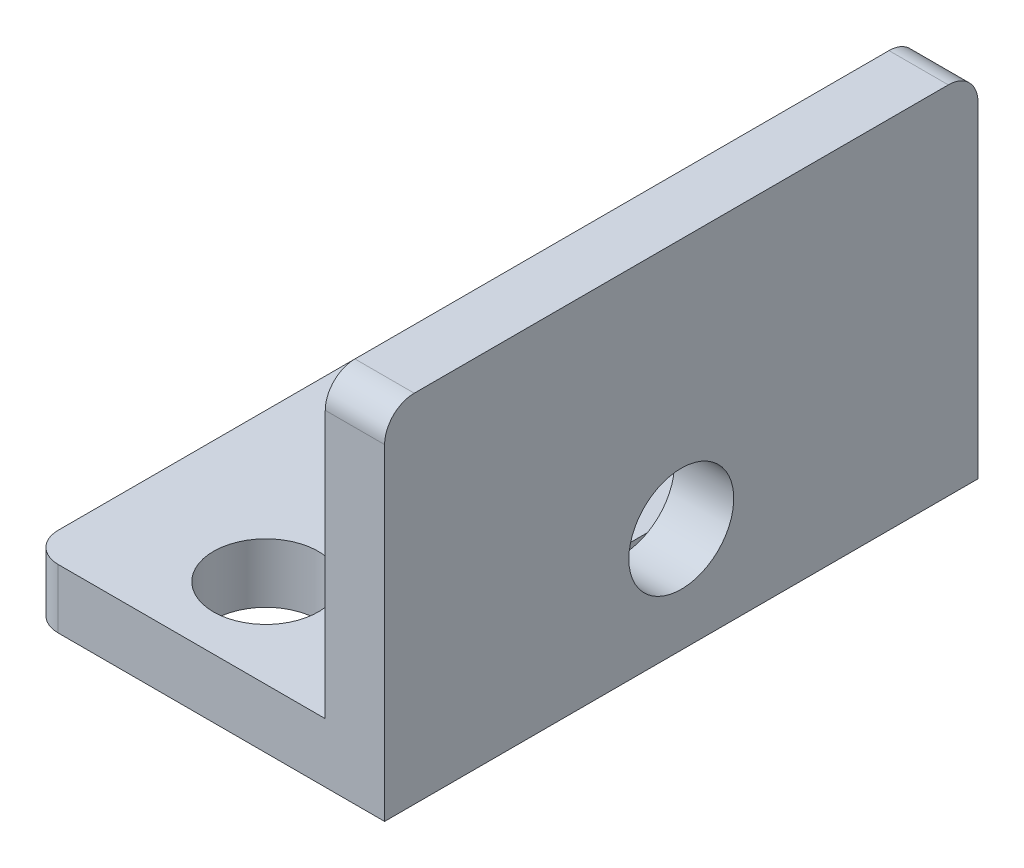
from build123d import *

# Parameters (mm, degrees)
BOSS_EXTRUDE1_DEPTH        = 31.75
F_10_CLEARANCE_HOLE1_D     = 5.6134
F_10_CLEARANCE_HOLE1_DEPTH = 25.4
F_10_CLEARANCE_HOLE1_TIP   = 1.686435499
FILLET1_R                  = 1.5875


with BuildPart() as part:
    # Sketch1 → Boss-Extrude1 (new body)
    with BuildSketch(Plane.XY):
        Polygon((0, 0), (0, 19.05), (-3.175, 19.05), (-3.175, 3.175), (-19.05, 3.175), (-19.05, 0), align=None)
    extrude(amount=BOSS_EXTRUDE1_DEPTH)

    # #10 Clearance Hole1
    with Locations(Plane(origin=(0, 3.175, 0), x_dir=(1, 0, 0), z_dir=(0, 1, 0))):
        with Locations((-11.1125, -26.9875), (-11.1125, -4.7625)):
            Hole(F_10_CLEARANCE_HOLE1_D / 2, depth=F_10_CLEARANCE_HOLE1_DEPTH)
            with Locations((0, 0, -(F_10_CLEARANCE_HOLE1_DEPTH + F_10_CLEARANCE_HOLE1_TIP / 2))):  # 118° drill point
                Cone(0, F_10_CLEARANCE_HOLE1_D / 2, F_10_CLEARANCE_HOLE1_TIP, mode=Mode.SUBTRACT)

    # Sketch5 → #10 Clearance Hole2 (revolve, cut)
    with BuildSketch(Plane(origin=(-3.175, 5.6261, 15.875), x_dir=(0, 0, 1), z_dir=(0, 1, 0))):
        Polygon((0, 0), (0, 27.086435499), (2.8067, 25.4), (2.8067, 0), align=None)
    revolve(axis=Axis((-9.525, 5.6261, 15.875), (1, 0, 0)), mode=Mode.SUBTRACT)

    # Fillet1
    fillet1_edges = [part.edges().sort_by_distance(p)[0] for p in [
        (-1.5875, 19.05, 31.75),
        (-19.05, 1.5875, 31.75),
        (-19.05, 1.5875, 0),
        (-1.5875, 19.05, 0),
    ]]
    fillet(fillet1_edges, radius=FILLET1_R)


solid = part.part
